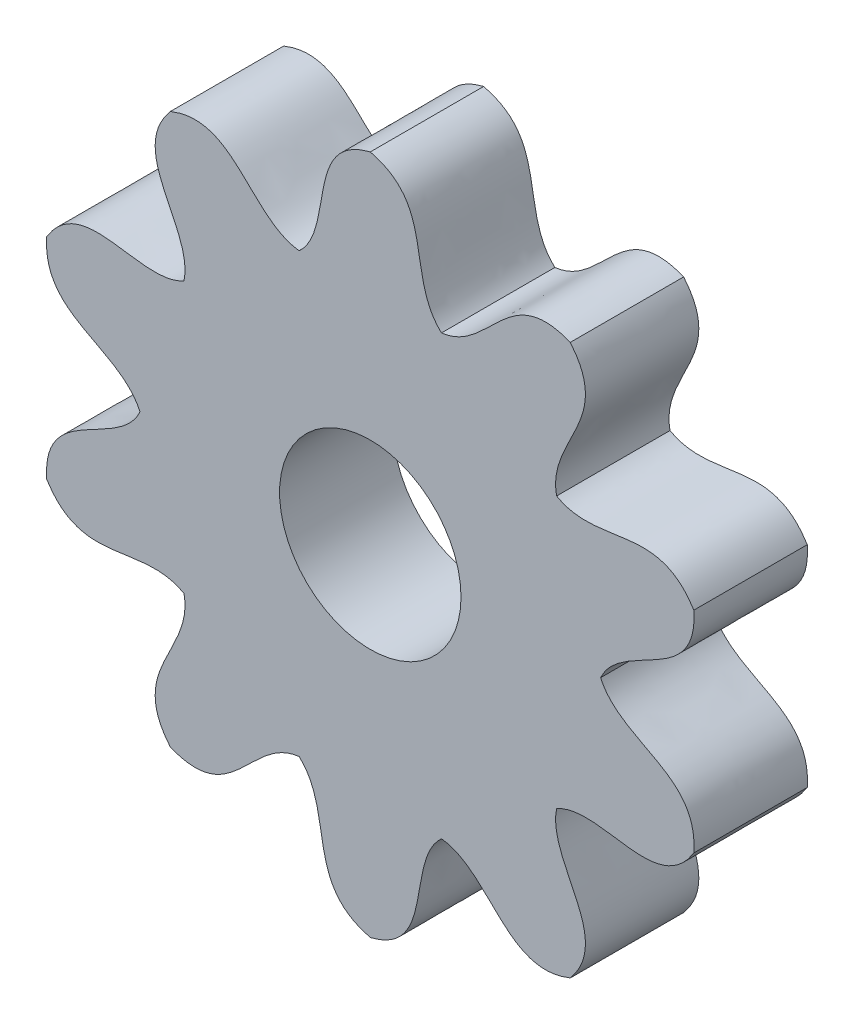
from build123d import *

# Parameters (mm, degrees)
SKETCH1_R           = 4
BOSS_EXTRUDE1_DEPTH = 5


with BuildPart() as part:
    # Sketch1 → Boss-Extrude1 (new body)
    with BuildSketch(Plane.XY):
        with BuildLine():
            add(Edge.make_bspline(
                [(0, 15), (2.939188217, 14.272515919), (1.529993599, 11.135281605), (3.13745877, 9.656105206)],
                knots=[0, 0, 0, 0, 0.926158454, 0.926158454, 0.926158454, 0.926158454], degree=3))
            add(Edge.make_bspline(
                [(0, 15), (-2.939188224, 14.272515918), (-1.529993593, 11.13528159), (-3.137458782, 9.656105196)],
                knots=[0, 0, 0, 0, 0.926158457, 0.926158457, 0.926158457, 0.926158457], degree=3))
            add(Edge.make_bspline(
                [(-8.816778784, 12.135254916), (-6.01132116, 13.274319416), (-5.307363487, 9.907939744), (-3.137458785, 9.656105208)],
                knots=[0, 0, 0, 0, 0.926158452, 0.926158452, 0.926158452, 0.926158452], degree=3))
            add(Edge.make_bspline(
                [(-8.816778784, 12.135254916), (-10.767027588, 9.819096444), (-7.782945131, 8.109324382), (-8.213973699, 5.967801216)],
                knots=[0, 0, 0, 0, 0.926158454, 0.926158454, 0.926158454, 0.926158454], degree=3))
            add(Edge.make_bspline(
                [(-14.265847744, 4.635254916), (-12.66571016, 7.205784078), (-10.117488108, 4.896101636), (-8.213973699, 5.967801216)],
                knots=[0, 0, 0, 0, 0.926158454, 0.926158454, 0.926158454, 0.926158454], degree=3))
            add(Edge.make_bspline(
                [(-14.265847744, 4.635254916), (-14.482228378, 1.615115865), (-11.063076155, 1.98588087), (-10.153029858, 0)],
                knots=[0, 0, 0, 0, 0.926158454, 0.926158454, 0.926158454, 0.926158454], degree=3))
            add(Edge.make_bspline(
                [(-14.265847744, -4.635254916), (-14.482228378, -1.615115865), (-11.063076155, -1.98588087), (-10.153029858, 0)],
                knots=[0, 0, 0, 0, 0.926158454, 0.926158454, 0.926158454, 0.926158454], degree=3))
            add(Edge.make_bspline(
                [(-14.265847744, -4.635254916), (-12.665710158, -7.205784082), (-10.117488099, -4.896101628), (-8.21397369, -5.967801222)],
                knots=[0, 0, 0, 0, 0.926158456, 0.926158456, 0.926158456, 0.926158456], degree=3))
            add(Edge.make_bspline(
                [(-8.816778784, -12.135254916), (-10.767027584, -9.819096448), (-7.782945142, -8.109324388), (-8.213973697, -5.967801228)],
                knots=[0, 0, 0, 0, 0.926158453, 0.926158453, 0.926158453, 0.926158453], degree=3))
            add(Edge.make_bspline(
                [(-8.816778784, -12.135254916), (-6.01132116, -13.274319416), (-5.307363487, -9.907939744), (-3.137458785, -9.656105208)],
                knots=[0, 0, 0, 0, 0.926158452, 0.926158452, 0.926158452, 0.926158452], degree=3))
            add(Edge.make_bspline(
                [(0, -15), (-2.939188224, -14.272515918), (-1.529993593, -11.13528159), (-3.137458782, -9.656105196)],
                knots=[0, 0, 0, 0, 0.926158457, 0.926158457, 0.926158457, 0.926158457], degree=3))
            add(Edge.make_bspline(
                [(0, -15), (2.939188224, -14.272515918), (1.529993593, -11.13528159), (3.137458782, -9.656105196)],
                knots=[0, 0, 0, 0, 0.926158457, 0.926158457, 0.926158457, 0.926158457], degree=3))
            add(Edge.make_bspline(
                [(8.816778784, -12.135254916), (6.01132116, -13.274319416), (5.307363487, -9.907939744), (3.137458785, -9.656105208)],
                knots=[0, 0, 0, 0, 0.926158452, 0.926158452, 0.926158452, 0.926158452], degree=3))
            add(Edge.make_bspline(
                [(8.816778784, -12.135254916), (10.767027588, -9.819096444), (7.782945131, -8.109324382), (8.213973699, -5.967801216)],
                knots=[0, 0, 0, 0, 0.926158454, 0.926158454, 0.926158454, 0.926158454], degree=3))
            add(Edge.make_bspline(
                [(14.265847744, -4.635254916), (12.66571016, -7.205784078), (10.117488108, -4.896101636), (8.213973699, -5.967801216)],
                knots=[0, 0, 0, 0, 0.926158454, 0.926158454, 0.926158454, 0.926158454], degree=3))
            add(Edge.make_bspline(
                [(14.265847744, -4.635254916), (14.482228378, -1.615115865), (11.063076155, -1.98588087), (10.153029858, 0)],
                knots=[0, 0, 0, 0, 0.926158454, 0.926158454, 0.926158454, 0.926158454], degree=3))
            add(Edge.make_bspline(
                [(14.265847744, 4.635254916), (14.482228378, 1.615115865), (11.063076155, 1.98588087), (10.153029858, 0)],
                knots=[0, 0, 0, 0, 0.926158454, 0.926158454, 0.926158454, 0.926158454], degree=3))
            add(Edge.make_bspline(
                [(14.265847744, 4.635254916), (12.665710158, 7.205784082), (10.117488099, 4.896101628), (8.21397369, 5.967801222)],
                knots=[0, 0, 0, 0, 0.926158456, 0.926158456, 0.926158456, 0.926158456], degree=3))
            add(Edge.make_bspline(
                [(8.816778784, 12.135254916), (10.767027584, 9.819096448), (7.782945142, 8.109324388), (8.213973697, 5.967801228)],
                knots=[0, 0, 0, 0, 0.926158453, 0.926158453, 0.926158453, 0.926158453], degree=3))
            add(Edge.make_bspline(
                [(8.816778784, 12.135254916), (6.011321153, 13.274319419), (5.307363484, 9.907939729), (3.13745877, 9.656105206)],
                knots=[0, 0, 0, 0, 0.926158454, 0.926158454, 0.926158454, 0.926158454], degree=3))
        make_face()
        Circle(SKETCH1_R, mode=Mode.SUBTRACT)
    extrude(amount=BOSS_EXTRUDE1_DEPTH)


solid = part.part
